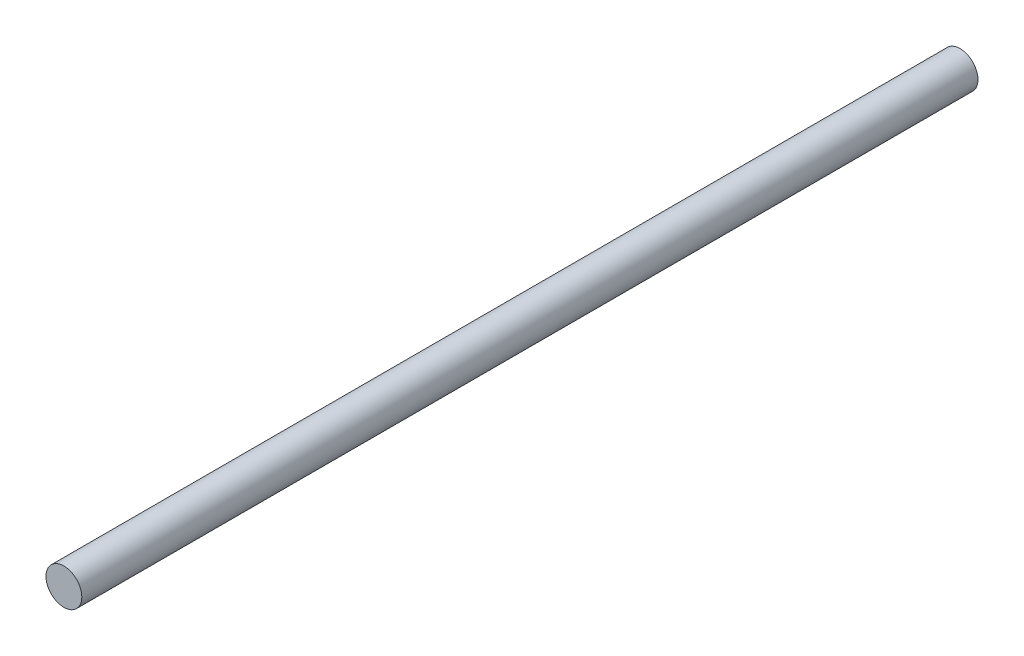
from build123d import *

# Parameters (mm, degrees)
SKETCH1_R           = 10
BOSS_EXTRUDE1_DEPTH = 250


with BuildPart() as part:
    # Sketch1 → Boss-Extrude1 (new, symmetric)
    with BuildSketch(Plane.XY):
        Circle(SKETCH1_R)
    extrude(amount=BOSS_EXTRUDE1_DEPTH, both=True)


solid = part.part
